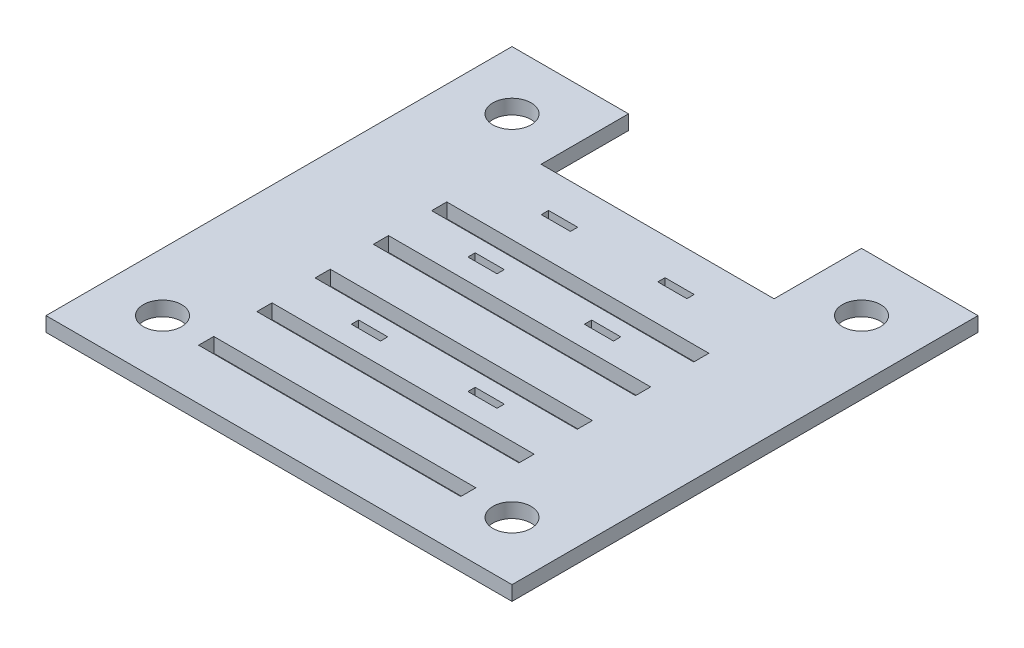
from build123d import *

# Parameters (mm, degrees)
SKETCH1_W           = 203.2
SKETCH1_H           = 203.2
BOSS_EXTRUDE1_DEPTH = 6.35
SKETCH3_R           = 8.334375
SKETCH3_W           = 101.6
SKETCH3_H           = 38.1
CUT_EXTRUDE1_DEPTH  = 144.824345992
SKETCH4_W           = 114.3
SKETCH4_H           = 6.604
CUT_EXTRUDE2_DEPTH  = 144.824345992
SKETCH5_W           = 12.7
SKETCH5_H           = 3.175
CUT_EXTRUDE3_DEPTH  = 144.824345992


with BuildPart() as part:
    # Sketch1 → Boss-Extrude1 (new body)
    with BuildSketch(Plane(origin=(0, 0, 0), x_dir=(1, 0, 0), z_dir=(0, 1, 0))):
        Rectangle(SKETCH1_W, SKETCH1_H)
    extrude(amount=BOSS_EXTRUDE1_DEPTH)

    # Sketch3 → Cut-Extrude1 (cut, through all)
    with BuildSketch(Plane(origin=(0, 6.35, 0), x_dir=(1, 0, 0), z_dir=(0, 1, 0))):
        with Locations(Location((-76.2, 76.2, 0), (0, 0, 270))):
            Circle(SKETCH3_R)
        with Locations(Location((76.2, 76.2, 0), (0, 0, 270))):
            Circle(SKETCH3_R)
        with Locations(Location((-76.2, -76.2, 0), (0, 0, 270))):
            Circle(SKETCH3_R)
        with Locations(Location((76.2, -76.2, 0), (0, 0, 270))):
            Circle(SKETCH3_R)
        with Locations((0, 82.55)):
            Rectangle(SKETCH3_W, SKETCH3_H)
    extrude(amount=-CUT_EXTRUDE1_DEPTH, mode=Mode.SUBTRACT)

    # Sketch4 → Cut-Extrude2 (cut, through all)
    with BuildSketch(Plane(origin=(0, 6.35, 0), x_dir=(1, 0, 0), z_dir=(0, 1, 0))):
        with Locations((0, -50.8)):
            Rectangle(SKETCH4_W, SKETCH4_H)
        with Locations((0, 25.4)):
            Rectangle(SKETCH4_W, SKETCH4_H)
        with Locations((0, -76.2)):
            Rectangle(SKETCH4_W, SKETCH4_H)
        Rectangle(SKETCH4_W, SKETCH4_H)
        with Locations((0, -25.4)):
            Rectangle(SKETCH4_W, SKETCH4_H)
    extrude(amount=-CUT_EXTRUDE2_DEPTH, mode=Mode.SUBTRACT)

    # Sketch5 → Cut-Extrude3 (cut, through all)
    with BuildSketch(Plane(origin=(0, 6.35, 0), x_dir=(1, 0, 0), z_dir=(0, 1, 0))):
        with Locations((-25.4, 46.101)):
            Rectangle(SKETCH5_W, SKETCH5_H)
        with Locations((25.4, 46.101)):
            Rectangle(SKETCH5_W, SKETCH5_H)
        with Locations((-25.4, 14.101)):
            Rectangle(SKETCH5_W, SKETCH5_H)
        with Locations((25.4, 14.101)):
            Rectangle(SKETCH5_W, SKETCH5_H)
        with Locations((-25.4, -36.699)):
            Rectangle(SKETCH5_W, SKETCH5_H)
        with Locations((25.4, -36.699)):
            Rectangle(SKETCH5_W, SKETCH5_H)
    extrude(amount=-CUT_EXTRUDE3_DEPTH, mode=Mode.SUBTRACT)


solid = part.part
